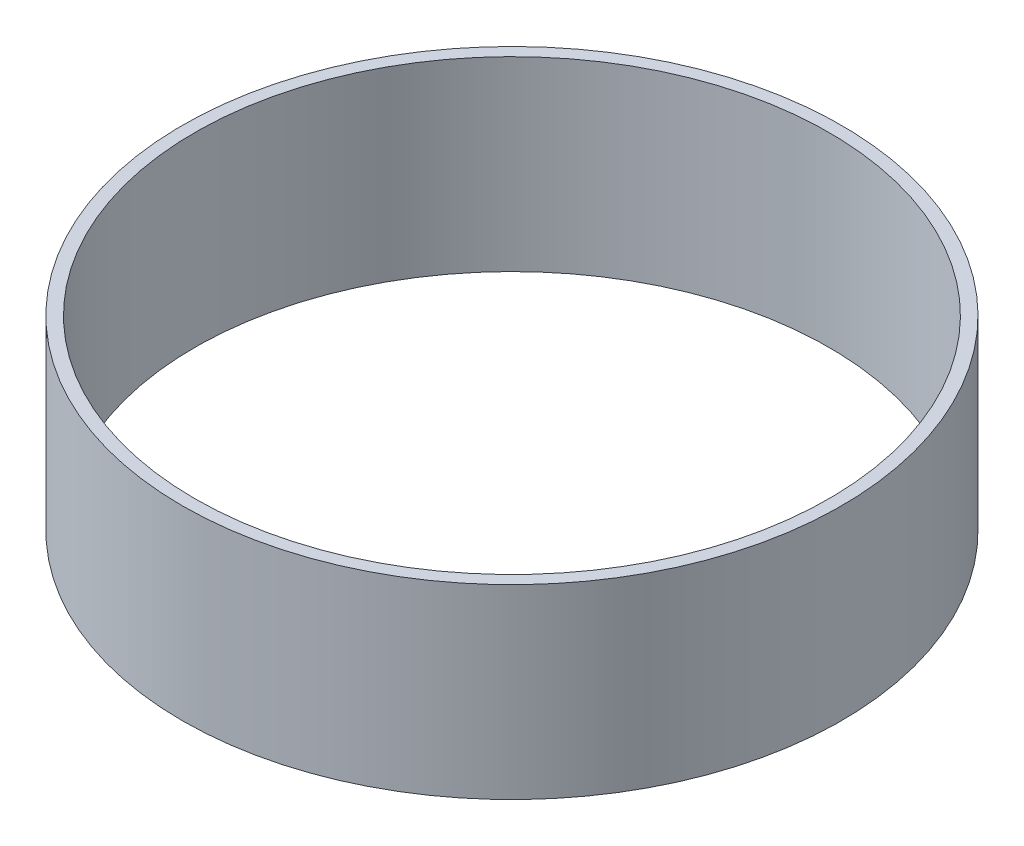
from build123d import *

# Parameters (mm, degrees)
SKETCH1_R           = 26.506
SKETCH1_R_2         = 25.506
BOSS_EXTRUDE1_DEPTH = 14.97


with BuildPart() as part:
    # Sketch1 → Boss-Extrude1 (new body)
    with BuildSketch(Plane(origin=(0, 0, 0), x_dir=(0.9999901068188848, 0, 0.004448175396225829), z_dir=(0, 1, 0))):
        with Locations(Location((-29.391570254, 2.611368154, 0), (0, 0, 270.254862517))):
            Circle(SKETCH1_R)
        with Locations(Location((-29.391570254, 2.611368154, 0), (0, 0, 270.254862517))):
            Circle(SKETCH1_R_2, mode=Mode.SUBTRACT)
    extrude(amount=BOSS_EXTRUDE1_DEPTH)


solid = part.part
